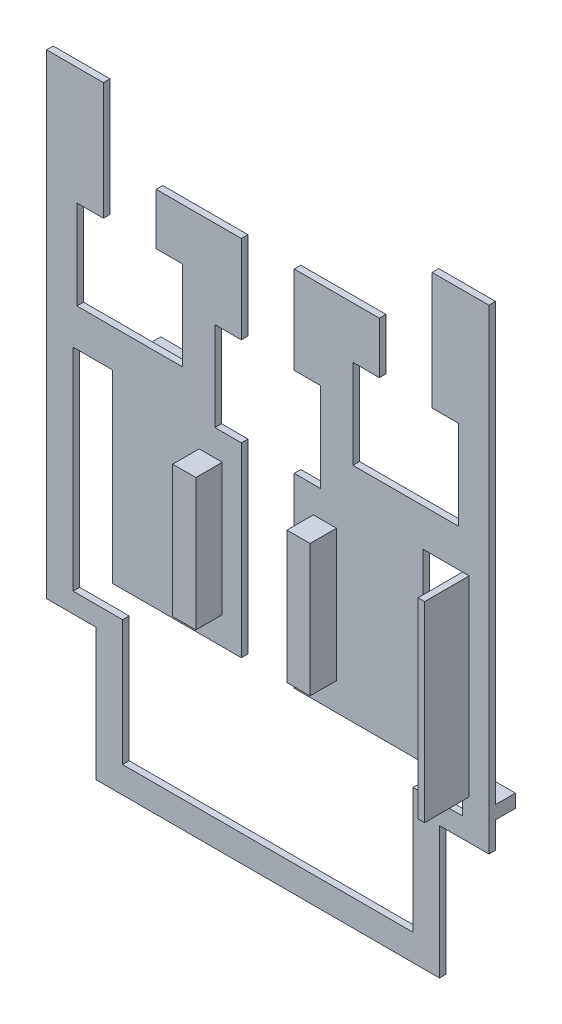
from build123d import *

# Parameters (mm, degrees)
BOSS_EXTRUDE1_DEPTH = 1
SKETCH2_W           = 16
SKETCH2_H           = 13.5
CUT_EXTRUDE2_DEPTH  = 1
SKETCH5_W           = 1
SKETCH5_H           = 29
BOSS_EXTRUDE3_DEPTH = 6.75
SKETCH6_W           = 3.5
SKETCH6_H           = 20
BOSS_EXTRUDE4_DEPTH = 4
SKETCH7_W           = 4
SKETCH7_H           = 2
SKETCH7_W_2         = 2
SKETCH7_H_2         = 10
BOSS_EXTRUDE5_DEPTH = 3


with BuildPart() as part:
    # Sketch1 → Boss-Extrude1 (new body)
    with BuildSketch(Plane.XY):
        Polygon((0, 0), (0, 72), (-33.5, 72), (-33.5, 0), (-26, 0), align=None)
        Polygon((26, 0), (33.5, 0), (33.5, 72), (0, 72), (0, 0), align=None)
        Polygon((26, -20), (26, 0), (0, 0), (-26, 0), (-26, -20), align=None)
    extrude(amount=BOSS_EXTRUDE1_DEPTH)

    # Sketch2 → Cut-Extrude2 (cut)
    with BuildSketch(Plane.XY.offset(1)):
        Polygon((22, -16), (-22, -16), (-22, 3), (-29.5, 3), (-29.5, 35), (-23.5, 35), (-23.5, 7), (-4, 7), (-4, 35.2), (-8, 35.2), (-8, 48.7), (-4, 48.7), (-4, 62), (-16.9, 62), (-16.9, 54.2), (-24.9, 54.2), (-24.9, 72), (-16.9, 72), (16.9, 72), (24.9, 72), (24.9, 54.2), (16.9, 54.2), (16.9, 62), (4, 62), (4, 48.7), (8, 48.7), (8, 35.2), (4, 35.2), (4, 7), (23.5, 7), (23.5, 35), (29.5, 35), (29.5, 3), (22, 3), align=None)
        with Locations((20.9, 47.45)):
            Rectangle(SKETCH2_W, SKETCH2_H)
        with Locations((-20.9, 47.45)):
            Rectangle(SKETCH2_W, SKETCH2_H)
    extrude(amount=-CUT_EXTRUDE2_DEPTH, mode=Mode.SUBTRACT)

    # Sketch5 → Boss-Extrude3 (add)
    with BuildSketch(Plane.XY.offset(1)):
        with Locations((30, 20.5)):
            Rectangle(SKETCH5_W, SKETCH5_H)
    extrude(amount=BOSS_EXTRUDE3_DEPTH)

    # Sketch6 → Boss-Extrude4 (add)
    with BuildSketch(Plane.XY.offset(1)):
        with Locations((8.65, 21.2)):
            Rectangle(SKETCH6_W, SKETCH6_H)
    boss_extrude4 = extrude(amount=BOSS_EXTRUDE4_DEPTH)

    # Mirror1: Boss-Extrude4 across plane
    add(boss_extrude4.mirror(Plane(origin=(0, 0, 0), x_dir=(0, 0, 1), z_dir=(1, 0, 0))))

    # Sketch7 → Boss-Extrude5 (add)
    with BuildSketch(Plane(origin=(0, 0, 0), x_dir=(-1, 0, 0), z_dir=(0, 0, -1))):
        Polygon((14.2, 29), (16.2, 29), (16.2, 37), (20.2, 37), (20.2, 39), (16.2, 39), (14.2, 39), align=None)
        with Locations((-31.5, 5)):
            Rectangle(SKETCH7_W, SKETCH7_H)
        with Locations((12, 25)):
            Rectangle(SKETCH7_W_2, SKETCH7_H_2)
    extrude(amount=BOSS_EXTRUDE5_DEPTH)


solid = part.part
